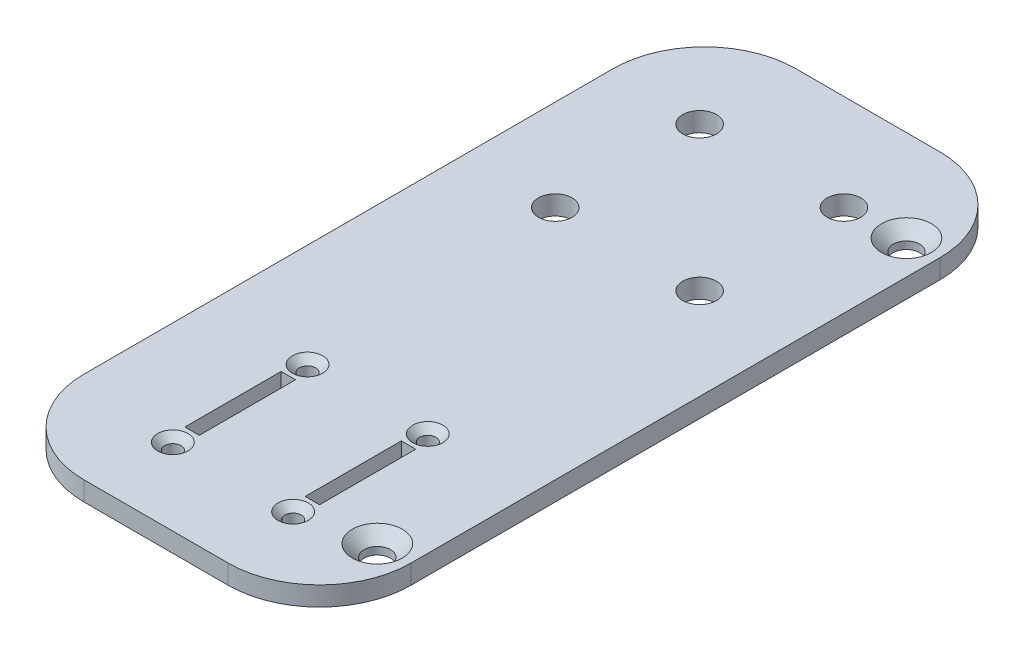
from build123d import *

# Parameters (mm, degrees)
SKETCH1_R                                     = 3.5
SKETCH1_R_2                                   = 1.5
SKETCH1_W                                     = 3
SKETCH1_H                                     = 20
BOSS_EXTRUDE1_DEPTH                           = 4
CSK_FOR_M5_COUNTERSUNK_FLAT_HEAD1_AT_2_COUNT  = 2
CSK_FOR_M5_COUNTERSUNK_FLAT_HEAD1_AT_2_PITCH  = 110
CSK_FOR_M3_COUNTERSUNK_FLAT_HEAD1_D           = 3.4
CSK_FOR_M3_COUNTERSUNK_FLAT_HEAD1_DEPTH       = 4
CSK_FOR_M3_COUNTERSUNK_FLAT_HEAD1_CSINK_D     = 6.3
CSK_FOR_M3_COUNTERSUNK_FLAT_HEAD1_CSINK_ANGLE = 90


with BuildPart() as part:
    # Sketch1 → Boss-Extrude1 (new body)
    with BuildSketch(Plane(origin=(0, 0, 0), x_dir=(1, 0, 0), z_dir=(0, 1, 0))):
        with BuildLine():
            Line((-15, -74), (15, -74))
            ThreePointArc((15, -74), (28.435028843, -68.435028843), (34, -55))
            Line((34, -55), (34, 55))
            ThreePointArc((34, 55), (28.435028843, 68.435028843), (15, 74))
            Line((15, 74), (-15, 74))
            ThreePointArc((-15, 74), (-28.435028843, 68.435028843), (-34, 55))
            Line((-34, 55), (-34, -55))
            ThreePointArc((-34, -55), (-28.435028843, -68.435028843), (-15, -74))
        make_face()
        with Locations(Location((-15, 54, 0), (0, 0, 270))):
            Circle(SKETCH1_R, mode=Mode.SUBTRACT)
        with Locations(Location((-15, 24, 0), (0, 0, 270))):
            Circle(SKETCH1_R, mode=Mode.SUBTRACT)
        with Locations(Location((15, 24, 0), (0, 0, 270))):
            Circle(SKETCH1_R, mode=Mode.SUBTRACT)
        with Locations(Location((15, 54, 0), (0, 0, 270))):
            Circle(SKETCH1_R, mode=Mode.SUBTRACT)
        with Locations(Location((-12.5, -30, 0), (0, 0, 270))):
            Circle(SKETCH1_R_2, mode=Mode.SUBTRACT)
        with Locations(Location((-12.5, -58, 0), (0, 0, 270))):
            Circle(SKETCH1_R_2, mode=Mode.SUBTRACT)
        with Locations(Location((12.5, -30, 0), (0, 0, 90))):
            Circle(SKETCH1_R_2, mode=Mode.SUBTRACT)
        with Locations(Location((12.5, -58, 0), (0, 0, 90))):
            Circle(SKETCH1_R_2, mode=Mode.SUBTRACT)
        with Locations((-12.5, -44)):
            Rectangle(SKETCH1_W, SKETCH1_H, mode=Mode.SUBTRACT)
        with Locations((12.5, -44)):
            Rectangle(SKETCH1_W, SKETCH1_H, mode=Mode.SUBTRACT)
    extrude(amount=BOSS_EXTRUDE1_DEPTH)

    # Sketch3 → CSK for M5 Countersunk Flat Head1 (revolve, cut)
    with BuildSketch(Plane(origin=(27, 4, -55), x_dir=(0, 0, 1), z_dir=(1, 0, 0))):
        Polygon((0, 0), (0, 4), (2.75, 4), (2.75, 2.45), (5.2, 0), align=None)
    csk_for_m5_countersunk_flat_head1 = revolve(axis=Axis((27, 10.35, -55), (0, -1, 0)), mode=Mode.SUBTRACT)

    # CSK for M5 Countersunk Flat Head1 at 2: CSK for M5 Countersunk Flat Head1 ×2
    with Locations(*[(0, 0, i * CSK_FOR_M5_COUNTERSUNK_FLAT_HEAD1_AT_2_PITCH) for i in range(1, CSK_FOR_M5_COUNTERSUNK_FLAT_HEAD1_AT_2_COUNT)]):
        add(csk_for_m5_countersunk_flat_head1, mode=Mode.SUBTRACT)

    # CSK for M3 Countersunk Flat Head1
    with Locations(Plane(origin=(0, 4, 0), x_dir=(1, 0, 0), z_dir=(0, 1, 0))):
        with Locations((-12.5, -30), (12.5, -30), (12.5, -58), (-12.5, -58)):
            CounterSinkHole(CSK_FOR_M3_COUNTERSUNK_FLAT_HEAD1_D / 2, CSK_FOR_M3_COUNTERSUNK_FLAT_HEAD1_CSINK_D / 2, depth=CSK_FOR_M3_COUNTERSUNK_FLAT_HEAD1_DEPTH, counter_sink_angle=CSK_FOR_M3_COUNTERSUNK_FLAT_HEAD1_CSINK_ANGLE)


solid = part.part
